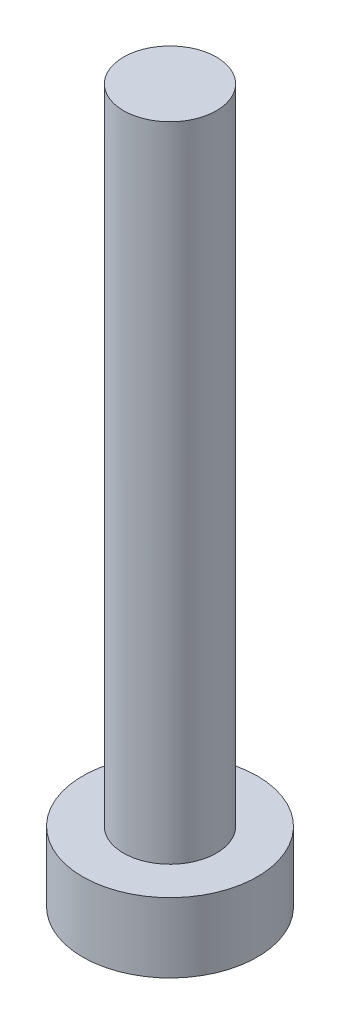
from build123d import *

# Parameters (mm, degrees)
SKETCH1_R           = 1.335
BOSS_EXTRUDE1_DEPTH = 18.48
SKETCH2_R           = 2.51
BOSS_EXTRUDE2_DEPTH = 2


with BuildPart() as part:
    # Sketch1 → Boss-Extrude1 (new body)
    with BuildSketch(Plane(origin=(0, 0, 0), x_dir=(1, 0, 0), z_dir=(0, 1, 0))):
        with Locations(Location((0, 0, 0), (0, 0, 270))):
            Circle(SKETCH1_R)
    extrude(amount=BOSS_EXTRUDE1_DEPTH)

    # Sketch2 → Boss-Extrude2 (add)
    with BuildSketch(Plane.XZ):
        with Locations(Location((0, 0, 0), (0, 0, 270))):
            Circle(SKETCH2_R)
    extrude(amount=BOSS_EXTRUDE2_DEPTH)


solid = part.part
